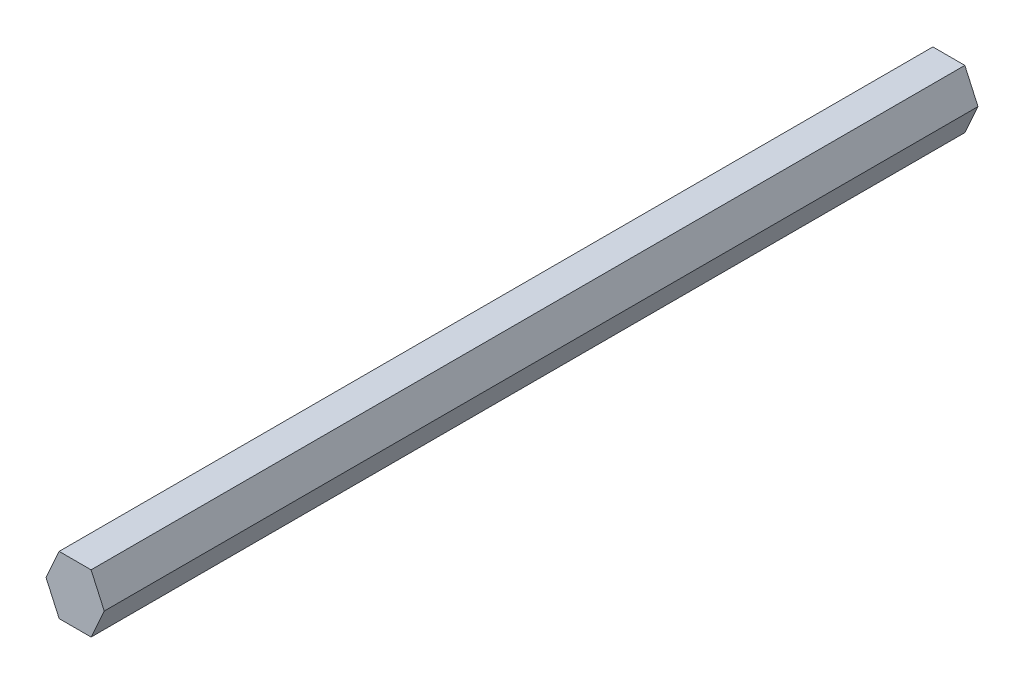
from build123d import *

# Parameters (mm, degrees)
BOSS_EXTRUDE1_DEPTH = 75


with BuildPart() as part:
    # Sketch1 → Boss-Extrude1 (new body)
    with BuildSketch(Plane.XY):
        Polygon((4.32829247, 2.19396745), (3.198852812, 4.693561556), (0.455933813, 4.693561556), (-0.67170753, 2.193155661), (0.457732128, -0.306438444), (3.200651127, -0.306438444), align=None)
    extrude(amount=BOSS_EXTRUDE1_DEPTH)


solid = part.part
